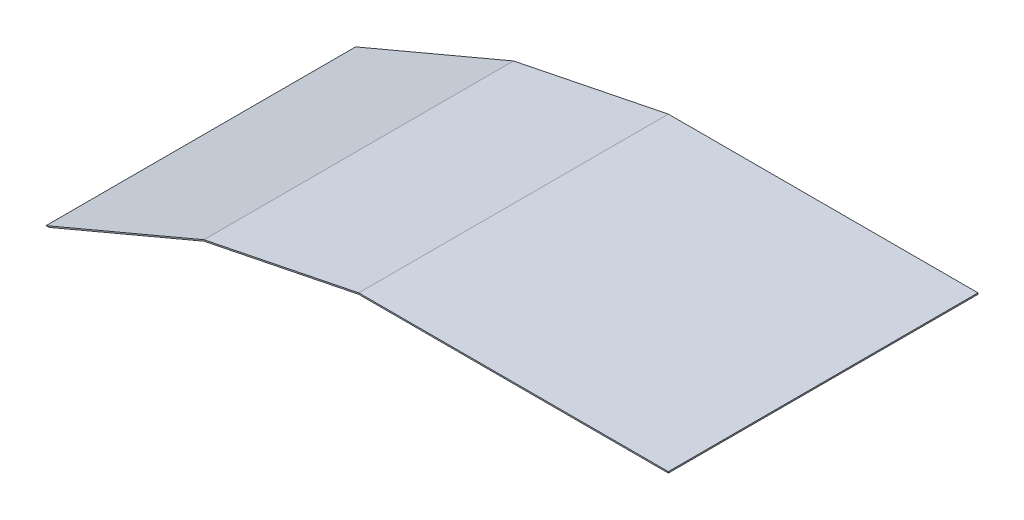
from build123d import *

# Parameters (mm, degrees)
EXTRUDE_1_DEPTH = 100


with BuildPart() as part:
    # 草图1 → 凸台-拉伸1 (new body)
    with BuildSketch(Plane.XY):
        Polygon((-200, 0), (-150, 21.139660937), (-100, 31.275162712), (0, 31.275162712), (0, 31.697955931), (-100, 31.697955931), (-150, 21.562454156), (-201, 0), align=None)
    extrude(amount=EXTRUDE_1_DEPTH)


solid = part.part
